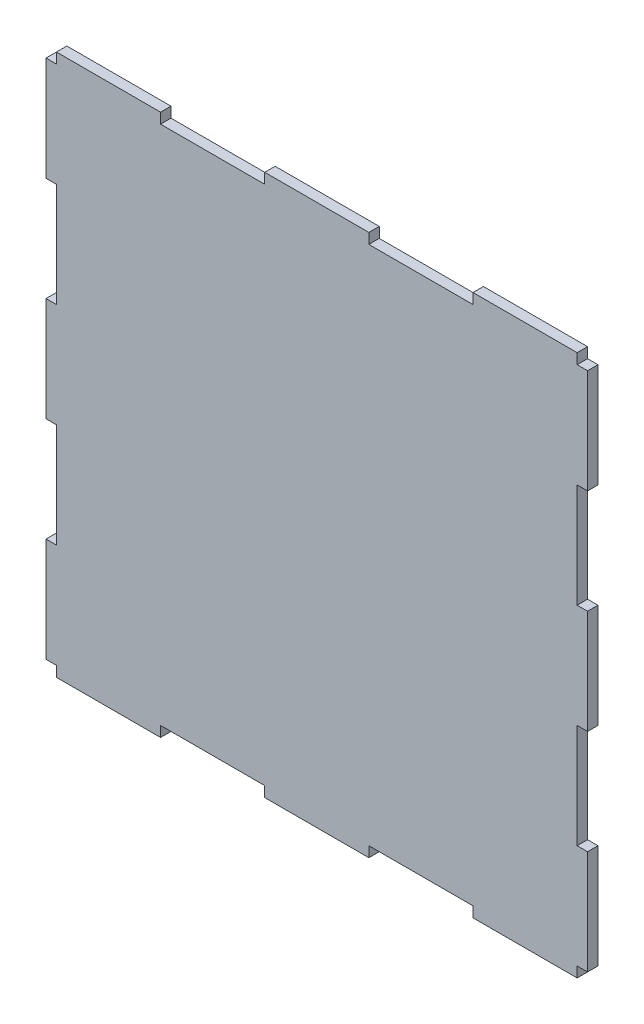
from build123d import *

# Parameters (mm, degrees)
RESSALTO_EXTRUS_O1_DEPTH = 3


with BuildPart() as part:
    # Esboço1 → Ressalto-extrusão1 (new body)
    with BuildSketch(Plane.XY):
        Polygon((-82.299614604, -120), (-82.299614604, -90), (-79.299614604, -90), (-79.299614604, -60), (-82.299614604, -60), (-82.299614604, -30), (-79.299614604, -30), (-79.299614604, 0), (-82.299614604, 0), (-82.299614604, 30), (-79.299614604, 30), (-79.299614604, 33), (-49.299614604, 33), (-49.299614604, 30), (-19.299614604, 30), (-19.299614604, 33), (10.700385396, 33), (10.700385396, 30), (40.700385396, 30), (40.700385396, 33), (70.700385396, 33), (70.700385396, 30), (73.700385396, 30), (73.700385396, 0), (70.700385396, 0), (70.700385396, -30), (73.700385396, -30), (73.700385396, -60), (70.700385396, -60), (70.700385396, -90), (73.700385396, -90), (73.700385396, -120), (70.700385396, -120), (70.700385396, -123), (40.700385396, -123), (40.700385396, -120), (10.700385396, -120), (10.700385396, -123), (-19.299614604, -123), (-19.299614604, -120), (-49.299614604, -120), (-49.299614604, -123), (-79.299614604, -123), (-79.299614604, -120), align=None)
    extrude(amount=RESSALTO_EXTRUS_O1_DEPTH)


solid = part.part
